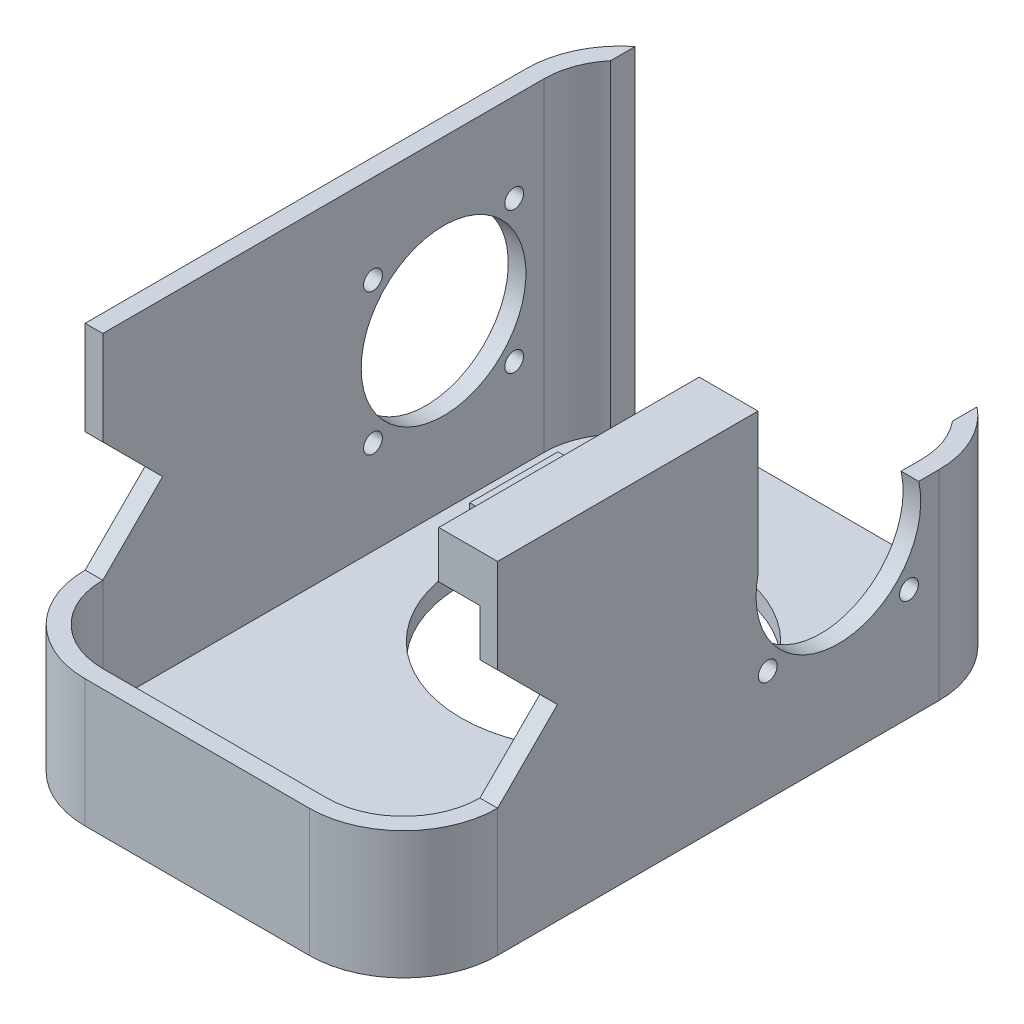
from build123d import *

# Parameters (mm, degrees)
SKETCH1_W           = 64.1
SKETCH1_H           = 75
BOSS_EXTRUDE1_DEPTH = 3
SKETCH1_4_W         = 3
SKETCH1_4_H         = 75
BOSS_EXTRUDE2_DEPTH = 58
SKETCH2_R           = 22.5
CUT_EXTRUDE1_DEPTH  = 10
FILLET2_R           = 16
BOSS_EXTRUDE3_START = 55
BOSS_EXTRUDE3_DEPTH = 55
SKETCH5_R           = 14
SKETCH5_R_2         = 1.6
CUT_EXTRUDE2_DEPTH  = 129.681816897
SKETCH7_W           = 43.224612372
SKETCH7_H           = 24
CUT_EXTRUDE3_DEPTH  = 10
SKETCH5_5_W         = 23.859751581
SKETCH5_5_H         = 20.349819761
CUT_EXTRUDE5_DEPTH  = 74
BOSS_EXTRUDE4_DEPTH = 7
SKETCH9_4_W         = 15
SKETCH9_4_H         = 3
BOSS_EXTRUDE5_DEPTH = 16


with BuildPart() as part:
    # Sketch1 → Boss-Extrude1 (new body)
    with BuildSketch(Plane(origin=(0, 0, 0), x_dir=(1, 0, 0), z_dir=(0, 1, 0))):
        Polygon((64.1, 75), (67.1, 75), (67.1, 91), (-3, 91), (-3, 75), (0, 75), align=None)
        with Locations((32.05, 37.5)):
            Rectangle(SKETCH1_W, SKETCH1_H)
        Polygon((67.1, 0), (67.1, -16), (-3, -16), (-3, 0), (0, 0), (64.1, 0), align=None)
    extrude(amount=BOSS_EXTRUDE1_DEPTH)

    # Sketch1<4> → Boss-Extrude2 (add)
    with BuildSketch(Plane(origin=(0, 0, 0), x_dir=(1, 0, 0), z_dir=(0, 1, 0))):
        with Locations((65.6, 37.5)):
            Rectangle(SKETCH1_4_W, SKETCH1_4_H)
        with Locations((-1.5, 37.5)):
            Rectangle(SKETCH1_4_W, SKETCH1_4_H)
    extrude(amount=BOSS_EXTRUDE2_DEPTH)

    # Sketch2 → Cut-Extrude1 (cut)
    with BuildSketch(Plane.XZ):
        with Locations(Location((32.05, -51.354505882, 0), (0, 0, 270))):
            Circle(SKETCH2_R)
    extrude(amount=-CUT_EXTRUDE1_DEPTH, mode=Mode.SUBTRACT)

    # Fillet2
    fillet2_edges = [part.edges().sort_by_distance(p)[0] for p in [
        (-3, 1.5, -91),
        (67.1, 1.5, -91),
        (67.1, 1.5, 16),
        (-3, 1.5, 16),
    ]]
    fillet(fillet2_edges, radius=FILLET2_R)

    # Sketch6 → Boss-Extrude3 (add)
    with BuildSketch(Plane(origin=(0, 3, 0), x_dir=(1, 0, 0), z_dir=(0, 1, 0)).offset(BOSS_EXTRUDE3_START)):
        with BuildLine():
            Line((3, 83.306623863), (3, 87.489995997))
            ThreePointArc((3, 87.489995997), (-1.422205102, 81.92820323), (-3, 75))
            Line((-3, 75), (0, 75))
            ThreePointArc((0, 75), (0.772980739, 79.415880433), (3, 83.306623863))
        make_face()
        with BuildLine():
            Line((61.1, 87.489995997), (61.1, 83.306623863))
            ThreePointArc((61.1, 83.306623863), (63.327019261, 79.415880433), (64.1, 75))
            Line((64.1, 75), (67.1, 75))
            ThreePointArc((67.1, 75), (65.522205102, 81.92820323), (61.1, 87.489995997))
        make_face()
        with BuildLine():
            Line((64.1, 0), (67.1, 0))
            ThreePointArc((67.1, 0), (62.413708499, -11.313708499), (51.1, -16))
            Line((51.1, -16), (13, -16))
            ThreePointArc((13, -16), (1.686291501, -11.313708499), (-3, 0))
            Line((-3, 0), (0, 0))
            ThreePointArc((0, 0), (3.807611845, -9.192388155), (13, -13))
            Line((13, -13), (51.1, -13))
            ThreePointArc((51.1, -13), (60.292388155, -9.192388155), (64.1, 0))
        make_face()
    extrude(amount=-BOSS_EXTRUDE3_DEPTH)

    # Sketch5 → Cut-Extrude2 (cut, through all)
    with BuildSketch(Plane.ZY.offset(3)):
        with Locations((-57.920720454, 30.91264254)):
            Circle(SKETCH5_R)
        with Locations((-69.920720454, 42.91264254)):
            Circle(SKETCH5_R_2)
        with Locations((-69.920720454, 18.91264254)):
            Circle(SKETCH5_R_2)
        with Locations((-45.920720454, 18.91264254)):
            Circle(SKETCH5_R_2)
        with Locations((-45.920720454, 42.91264254)):
            Circle(SKETCH5_R_2)
    extrude(amount=-CUT_EXTRUDE2_DEPTH, mode=Mode.SUBTRACT)

    # Sketch7 → Cut-Extrude3 (cut)
    with BuildSketch(Plane(origin=(67.1, 0, 0), x_dir=(0, 0, -1), z_dir=(1, 0, 0))):
        with Locations((65.877689811, 46)):
            Rectangle(SKETCH7_W, SKETCH7_H)
    extrude(amount=-CUT_EXTRUDE3_DEPTH, mode=Mode.SUBTRACT)

    # Sketch5<5> → Cut-Extrude5 (cut)
    with BuildSketch(Plane.ZY.offset(3)):
        Polygon((0, 58), (0, 42.024482082), (23.859751581, 42.024482082), (23.859751581, 64.276966148), (0, 64.276966148), align=None)
        with Locations((11.929875791, 31.849572202)):
            Rectangle(SKETCH5_5_W, SKETCH5_5_H)
        Polygon((0, 21.674662321), (0, 42.024482082), (-10.174909881, 31.849572202), align=None)
    extrude(amount=-CUT_EXTRUDE5_DEPTH, mode=Mode.SUBTRACT)

    # Sketch9 → Boss-Extrude4 (add)
    with BuildSketch(Plane.ZY.offset(-64.1)):
        Polygon((0, 58), (-44.265383625, 58), (-44.265383625, 50), (-29.265383625, 50), (-14.265383625, 50), (0, 50), align=None)
    extrude(amount=BOSS_EXTRUDE4_DEPTH)

    # Sketch9<4> → Boss-Extrude5 (add)
    with BuildSketch(Plane.ZY.offset(-64.1)):
        with Locations((-21.765383625, 48.5)):
            Rectangle(SKETCH9_4_W, SKETCH9_4_H)
    extrude(amount=BOSS_EXTRUDE5_DEPTH)


solid = part.part
